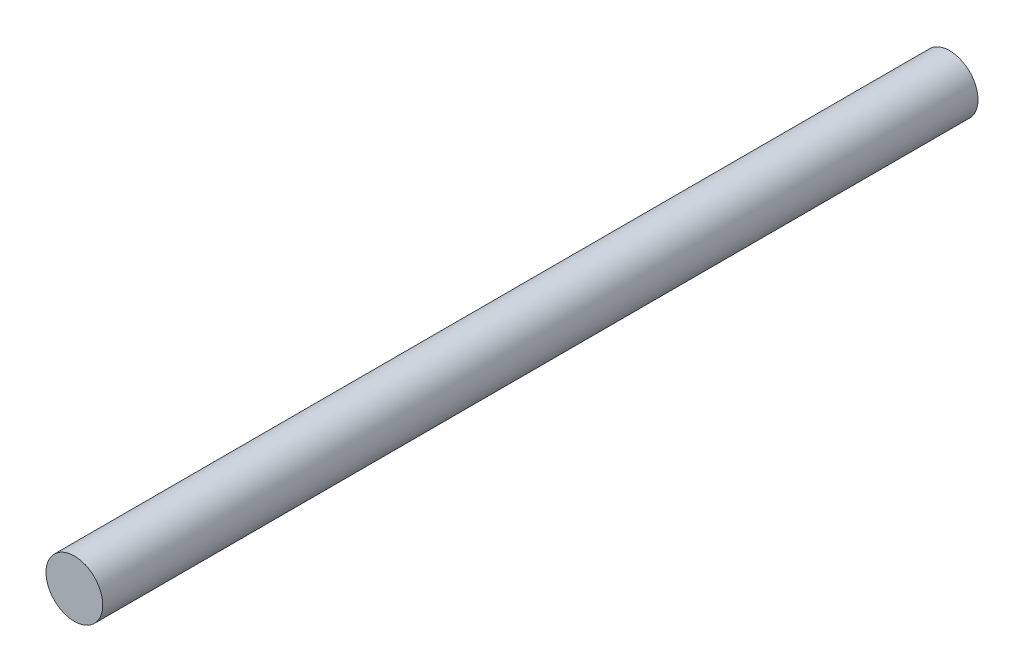
from build123d import *

# Parameters (mm, degrees)
SKETCH1_R           = 11.1125
BOSS_EXTRUDE1_DEPTH = 342.9


with BuildPart() as part:
    # Sketch1 → Boss-Extrude1 (new body)
    with BuildSketch(Plane.XY):
        with Locations(Location((139.1866152, 19.2438528, 0), (0, 0, 180))):
            Circle(SKETCH1_R)
    extrude(amount=BOSS_EXTRUDE1_DEPTH)


solid = part.part
